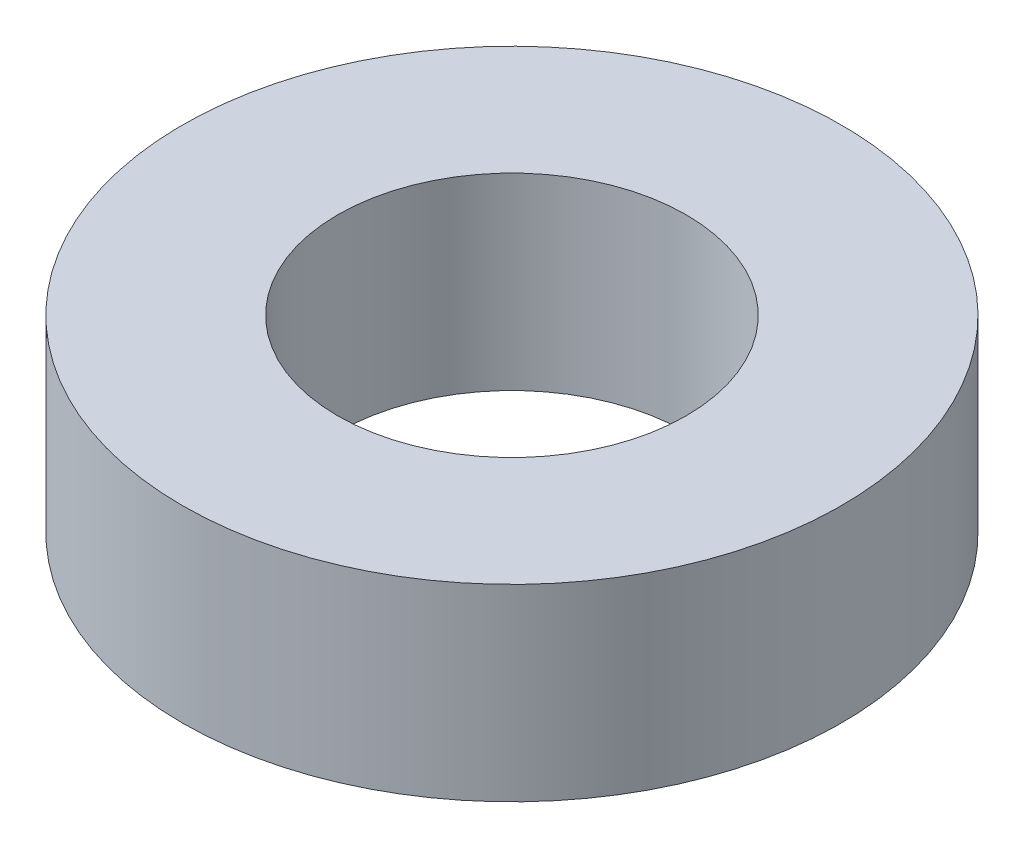
from build123d import *

# Parameters (mm, degrees)
SKETCH_1_R      = 3.5
SKETCH_1_R_2    = 1.85
EXTRUDE_1_DEPTH = 2


with BuildPart() as part:
    # 草图1 → 凸台-拉伸1 (new body)
    with BuildSketch(Plane(origin=(0, 0, 0), x_dir=(1, 0, 0), z_dir=(0, 1, 0))):
        with Locations(Location((0, 0, 0), (0, 0, 270))):
            Circle(SKETCH_1_R)
        with Locations(Location((0, 0, 0), (0, 0, 270))):
            Circle(SKETCH_1_R_2, mode=Mode.SUBTRACT)
    extrude(amount=EXTRUDE_1_DEPTH)


solid = part.part
